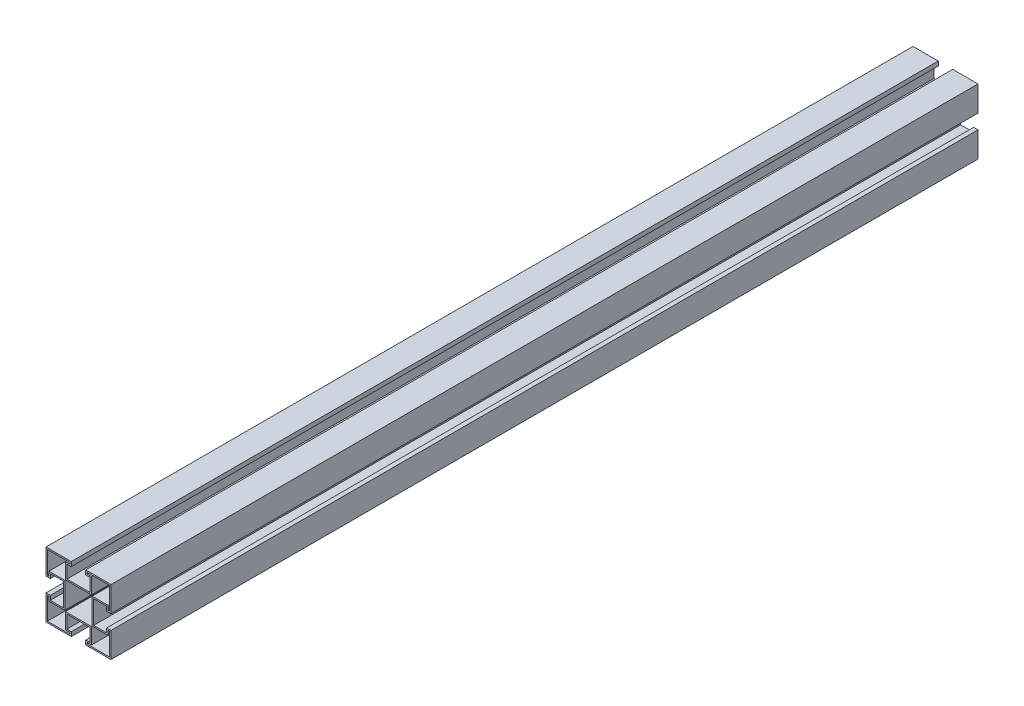
from build123d import *

# Parameters (mm, degrees)
BOSS_EXTRUDE2_DEPTH = 300


with BuildPart() as part:
    # Sketch1 → Boss-Extrude2 (new, symmetric)
    with BuildSketch(Plane.XY):
        Polygon((-5, 22.5), (-5, 19.5), (-8, 19.5), (-8, 10.5), (8, 10.5), (8, 19.5), (5, 19.5), (5, 22.5), (22.5, 22.5), (22.5, 5), (19.5, 5), (19.5, 8), (10.5, 8), (10.5, -8), (19.5, -8), (19.5, -5), (22.5, -5), (22.5, -22.5), (5, -22.5), (5, -19.5), (8, -19.5), (8, -10.5), (-8, -10.5), (-8, -19.5), (-5, -19.5), (-5, -22.5), (-22.5, -22.5), (-22.5, -5), (-19.5, -5), (-19.5, -8), (-10.5, -8), (-10.5, 8), (-19.5, 8), (-19.5, 5), (-22.5, 5), (-22.5, 22.5), align=None)
        Polygon((-6, 21.5), (-21.5, 21.5), (-21.5, 6), (-20.5, 6), (-20.5, 9), (-9.5, 9), (-9.5, -9), (-20.5, -9), (-20.5, -6), (-21.5, -6), (-21.5, -21.5), (-6, -21.5), (-6, -20.5), (-9, -20.5), (-9, -9.5), (9, -9.5), (9, -20.5), (6, -20.5), (6, -21.5), (21.5, -21.5), (21.5, -6), (20.5, -6), (20.5, -9), (9.5, -9), (9.5, 9), (20.5, 9), (20.5, 6), (21.5, 6), (21.5, 21.5), (6, 21.5), (6, 20.5), (9, 20.5), (9, 9.5), (-9, 9.5), (-9, 20.5), (-6, 20.5), align=None, mode=Mode.SUBTRACT)
    extrude(amount=BOSS_EXTRUDE2_DEPTH, both=True)


solid = part.part
